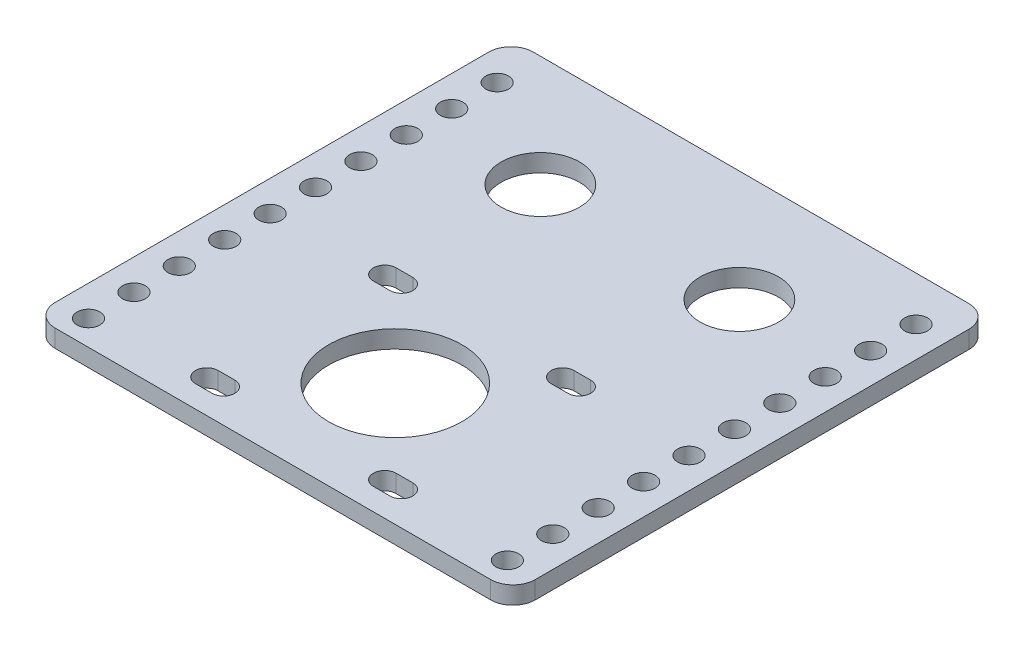
from build123d import *

# Parameters (mm, degrees)
SKETCH1_W           = 86.35
SKETCH1_H           = 86
SKETCH1_R           = 2.05
BOSS_EXTRUDE1_DEPTH = 3.175
FILLET1_R           = 4
SKETCH2_R           = 7.05
SKETCH2_R_2         = 12
CUT_EXTRUDE1_DEPTH  = 3.18


with BuildPart() as part:
    # Sketch1 → Boss-Extrude1 (new body)
    with BuildSketch(Plane(origin=(0, 0, 0), x_dir=(1, 0, 0), z_dir=(0, 1, 0))):
        Rectangle(SKETCH1_W, SKETCH1_H)
        with Locations(Location((37.675, 35, 0), (0, 0, 270))):
            Circle(SKETCH1_R, mode=Mode.SUBTRACT)
        with Locations(Location((37.675, 26.832661921, 0), (0, 0, 270))):
            Circle(SKETCH1_R, mode=Mode.SUBTRACT)
        with Locations(Location((37.675, 18.665323842, 0), (0, 0, 270))):
            Circle(SKETCH1_R, mode=Mode.SUBTRACT)
        with Locations(Location((37.675, 10.497985763, 0), (0, 0, 270))):
            Circle(SKETCH1_R, mode=Mode.SUBTRACT)
        with Locations(Location((37.675, 2.330647684, 0), (0, 0, 270))):
            Circle(SKETCH1_R, mode=Mode.SUBTRACT)
        with Locations(Location((37.675, -5.836690395, 0), (0, 0, 270))):
            Circle(SKETCH1_R, mode=Mode.SUBTRACT)
        with Locations(Location((37.675, -14.004028475, 0), (0, 0, 270))):
            Circle(SKETCH1_R, mode=Mode.SUBTRACT)
        with Locations(Location((37.675, -22.171366554, 0), (0, 0, 270))):
            Circle(SKETCH1_R, mode=Mode.SUBTRACT)
        with Locations(Location((37.675, -30.338704633, 0), (0, 0, 270))):
            Circle(SKETCH1_R, mode=Mode.SUBTRACT)
        with Locations(Location((37.675, -38.506042712, 0), (0, 0, 270))):
            Circle(SKETCH1_R, mode=Mode.SUBTRACT)
        with Locations(Location((-37.675, -38.506042712, 0), (0, 0, 90))):
            Circle(SKETCH1_R, mode=Mode.SUBTRACT)
        with Locations(Location((-37.675, -30.338704633, 0), (0, 0, 90))):
            Circle(SKETCH1_R, mode=Mode.SUBTRACT)
        with Locations(Location((-37.675, -22.171366554, 0), (0, 0, 90))):
            Circle(SKETCH1_R, mode=Mode.SUBTRACT)
        with Locations(Location((-37.675, -14.004028475, 0), (0, 0, 90))):
            Circle(SKETCH1_R, mode=Mode.SUBTRACT)
        with Locations(Location((-37.675, -5.836690395, 0), (0, 0, 90))):
            Circle(SKETCH1_R, mode=Mode.SUBTRACT)
        with Locations(Location((-37.675, 2.330647684, 0), (0, 0, 90))):
            Circle(SKETCH1_R, mode=Mode.SUBTRACT)
        with Locations(Location((-37.675, 10.497985763, 0), (0, 0, 90))):
            Circle(SKETCH1_R, mode=Mode.SUBTRACT)
        with Locations(Location((-37.675, 18.665323842, 0), (0, 0, 90))):
            Circle(SKETCH1_R, mode=Mode.SUBTRACT)
        with Locations(Location((-37.675, 26.832661921, 0), (0, 0, 90))):
            Circle(SKETCH1_R, mode=Mode.SUBTRACT)
        with Locations(Location((-37.675, 35, 0), (0, 0, 90))):
            Circle(SKETCH1_R, mode=Mode.SUBTRACT)
    extrude(amount=BOSS_EXTRUDE1_DEPTH)

    # Fillet1
    fillet1_edges = [part.edges().sort_by_distance(p)[0] for p in [
        (43.175, 1.5875, 43),
        (-43.175, 1.5875, 43),
        (-43.175, 1.5875, -43),
        (43.175, 1.5875, -43),
    ]]
    fillet(fillet1_edges, radius=FILLET1_R)

    # Sketch2 → Cut-Extrude1 (cut)
    with BuildSketch(Plane(origin=(0, 3.175, 0), x_dir=(1, 0, 0), z_dir=(0, 1, 0))):
        with Locations(Location((-17.9, 23, 0), (0, 0, 270))):
            Circle(SKETCH2_R)
        with Locations(Location((17.9, 23, 0), (0, 0, 270))):
            Circle(SKETCH2_R)
        with Locations(Location((0, -20.993410297, 0), (0, 0, 270))):
            Circle(SKETCH2_R_2)
        with BuildLine():
            Line((-17.9, -7.043410297), (-14.9, -7.043410297))
            ThreePointArc((-14.9, -7.043410297), (-12.85, -4.993410297), (-14.9, -2.943410297))
            Line((-14.9, -2.943410297), (-17.9, -2.943410297))
            ThreePointArc((-17.9, -2.943410297), (-19.95, -4.993410297), (-17.9, -7.043410297))
        make_face()
        with BuildLine():
            Line((17.1, -2.943410297), (14.1, -2.943410297))
            ThreePointArc((14.1, -2.943410297), (12.05, -4.993410297), (14.1, -7.043410297))
            Line((14.1, -7.043410297), (17.1, -7.043410297))
            ThreePointArc((17.1, -7.043410297), (19.15, -4.993410297), (17.1, -2.943410297))
        make_face()
        with BuildLine():
            Line((14.1, -34.943410297), (17.1, -34.943410297))
            ThreePointArc((17.1, -34.943410297), (19.15, -36.993410297), (17.1, -39.043410297))
            Line((17.1, -39.043410297), (14.1, -39.043410297))
            ThreePointArc((14.1, -39.043410297), (12.05, -36.993410297), (14.1, -34.943410297))
        make_face()
        with BuildLine():
            Line((-17.9, -34.943410297), (-14.9, -34.943410297))
            ThreePointArc((-14.9, -34.943410297), (-12.85, -36.993410297), (-14.9, -39.043410297))
            Line((-14.9, -39.043410297), (-17.9, -39.043410297))
            ThreePointArc((-17.9, -39.043410297), (-19.95, -36.993410297), (-17.9, -34.943410297))
        make_face()
    extrude(amount=-CUT_EXTRUDE1_DEPTH, mode=Mode.SUBTRACT)


solid = part.part
